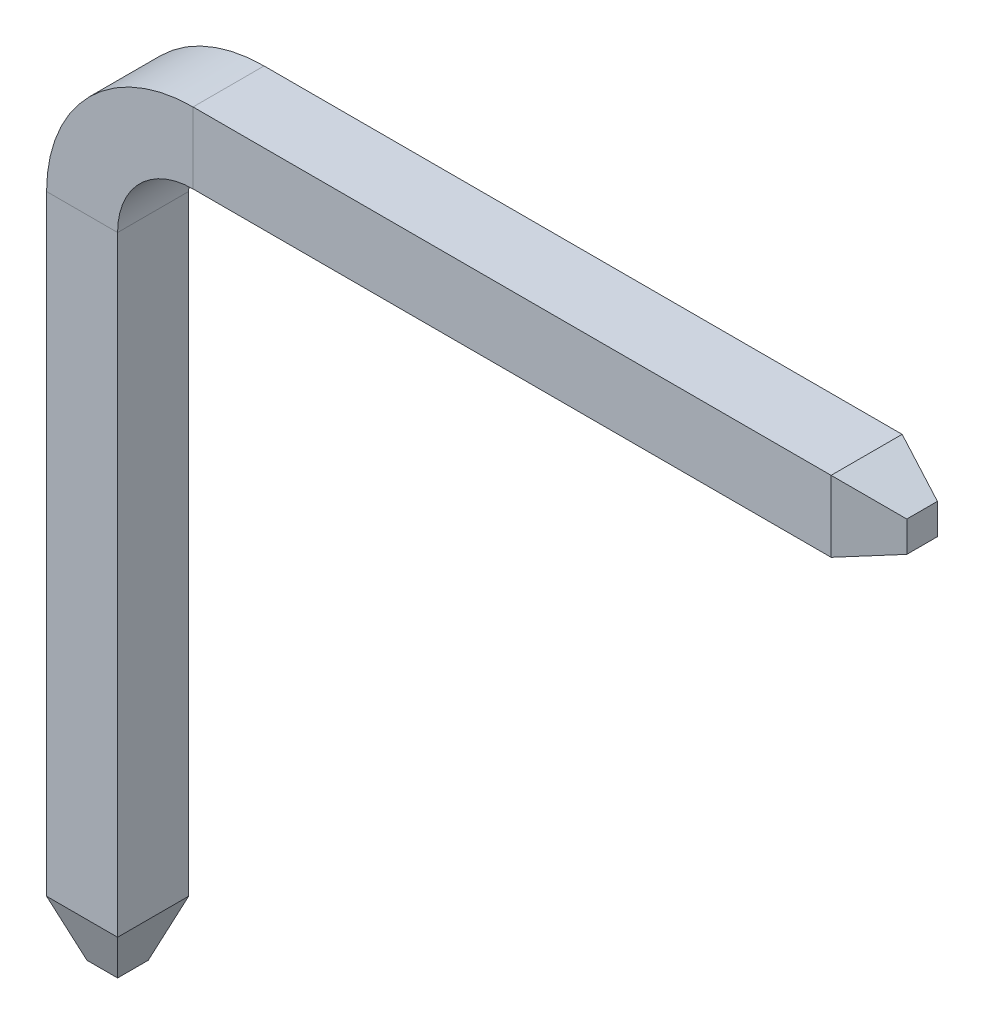
from build123d import *
from OCP.BRepFilletAPI import BRepFilletAPI_MakeChamfer

# Parameters (mm, degrees)
SKETCH_1_W      = 0.64
SKETCH_1_H      = 0.64
CHAMFER_1_SIZE  = 0.5
CHAMFER_1_SIZE2 = 0.181985117
CHAMFER_2_SIZE  = 0.5
CHAMFER_2_SIZE2 = 0.181985117


with BuildPart() as part:
    # По траектории1: sweep along a path in Эскиз2
    with BuildLine(Plane.XY) as sweep_1_path:
        Line((7.25, 2.75), (1, 2.75))
        ThreePointArc((1, 2.75), (0.292893219, 2.457106781), (0, 1.75))
        Line((0, 1.75), (0, 0))
        Line((0, 0), (0, -4.25))
    # Эскиз1 → По траектории1 (sweep)
    with BuildSketch(Plane(origin=(0, 0, 0), x_dir=(1, 0, 0), z_dir=(0, 1, 0))):
        Rectangle(SKETCH_1_W, SKETCH_1_H)
    sweep(path=sweep_1_path.line)

    # Фаска1: one chamfer whose edges measure the first distance from different faces: ONE call of the kernel's chamfer builder (chamfer() names one face for all edges)
    chamfer_1_edges_1 = [part.edges().sort_by_distance(p)[0] for p in [
        (7.25, 3.07, 0),
    ]]
    chamfer_1_side_1 = [part.faces().sort_by_distance(p)[0] for p in [
        (4.125, 3.07, 0),
    ]]
    chamfer_1_edges_2 = [part.edges().sort_by_distance(p)[0] for p in [
        (7.25, 2.75, 0.32),
    ]]
    chamfer_1_side_2 = [part.faces().sort_by_distance(p)[0] for p in [
        (4.125, 2.964696961, 0.32),
    ]]
    chamfer_1_edges_3 = [part.edges().sort_by_distance(p)[0] for p in [
        (7.25, 2.43, 0),
    ]]
    chamfer_1_side_3 = [part.faces().sort_by_distance(p)[0] for p in [
        (4.125, 2.43, 0),
    ]]
    chamfer_1_edges_4 = [part.edges().sort_by_distance(p)[0] for p in [
        (7.25, 2.75, -0.32),
    ]]
    chamfer_1_side_4 = [part.faces().sort_by_distance(p)[0] for p in [
        (4.125, 2.535303039, -0.32),
    ]]
    chamfer_1 = BRepFilletAPI_MakeChamfer(part.part.solid().wrapped)
    for e in chamfer_1_edges_1:
        chamfer_1.Add(CHAMFER_1_SIZE, CHAMFER_1_SIZE2, e.wrapped, chamfer_1_side_1[0].wrapped)  # the first distance lies on this face
    for e in chamfer_1_edges_2:
        chamfer_1.Add(CHAMFER_1_SIZE, CHAMFER_1_SIZE2, e.wrapped, chamfer_1_side_2[0].wrapped)  # the first distance lies on this face
    for e in chamfer_1_edges_3:
        chamfer_1.Add(CHAMFER_1_SIZE, CHAMFER_1_SIZE2, e.wrapped, chamfer_1_side_3[0].wrapped)  # the first distance lies on this face
    for e in chamfer_1_edges_4:
        chamfer_1.Add(CHAMFER_1_SIZE, CHAMFER_1_SIZE2, e.wrapped, chamfer_1_side_4[0].wrapped)  # the first distance lies on this face
    add(Compound.cast(chamfer_1.Shape()), mode=Mode.REPLACE)

    # Фаска2: one chamfer whose edges measure the first distance from different faces: ONE call of the kernel's chamfer builder (chamfer() names one face for all edges)
    chamfer_2_edges_1 = [part.edges().sort_by_distance(p)[0] for p in [
        (0, -4.25, 0.32),
    ]]
    chamfer_2_side_1 = [part.faces().sort_by_distance(p)[0] for p in [
        (3.875, 2.968231979, 0.32),
    ]]
    chamfer_2_edges_2 = [part.edges().sort_by_distance(p)[0] for p in [
        (0.32, -4.25, 0),
    ]]
    chamfer_2_side_2 = [part.faces().sort_by_distance(p)[0] for p in [
        (0.32, -1.25, 0),
    ]]
    chamfer_2_edges_3 = [part.edges().sort_by_distance(p)[0] for p in [
        (0, -4.25, -0.32),
    ]]
    chamfer_2_side_3 = [part.faces().sort_by_distance(p)[0] for p in [
        (3.875, 2.531768021, -0.32),
    ]]
    chamfer_2_edges_4 = [part.edges().sort_by_distance(p)[0] for p in [
        (-0.32, -4.25, 0),
    ]]
    chamfer_2_side_4 = [part.faces().sort_by_distance(p)[0] for p in [
        (-0.32, -1.25, 0),
    ]]
    chamfer_2 = BRepFilletAPI_MakeChamfer(part.part.solid().wrapped)
    for e in chamfer_2_edges_1:
        chamfer_2.Add(CHAMFER_2_SIZE, CHAMFER_2_SIZE2, e.wrapped, chamfer_2_side_1[0].wrapped)  # the first distance lies on this face
    for e in chamfer_2_edges_2:
        chamfer_2.Add(CHAMFER_2_SIZE, CHAMFER_2_SIZE2, e.wrapped, chamfer_2_side_2[0].wrapped)  # the first distance lies on this face
    for e in chamfer_2_edges_3:
        chamfer_2.Add(CHAMFER_2_SIZE, CHAMFER_2_SIZE2, e.wrapped, chamfer_2_side_3[0].wrapped)  # the first distance lies on this face
    for e in chamfer_2_edges_4:
        chamfer_2.Add(CHAMFER_2_SIZE, CHAMFER_2_SIZE2, e.wrapped, chamfer_2_side_4[0].wrapped)  # the first distance lies on this face
    add(Compound.cast(chamfer_2.Shape()), mode=Mode.REPLACE)


solid = part.part
